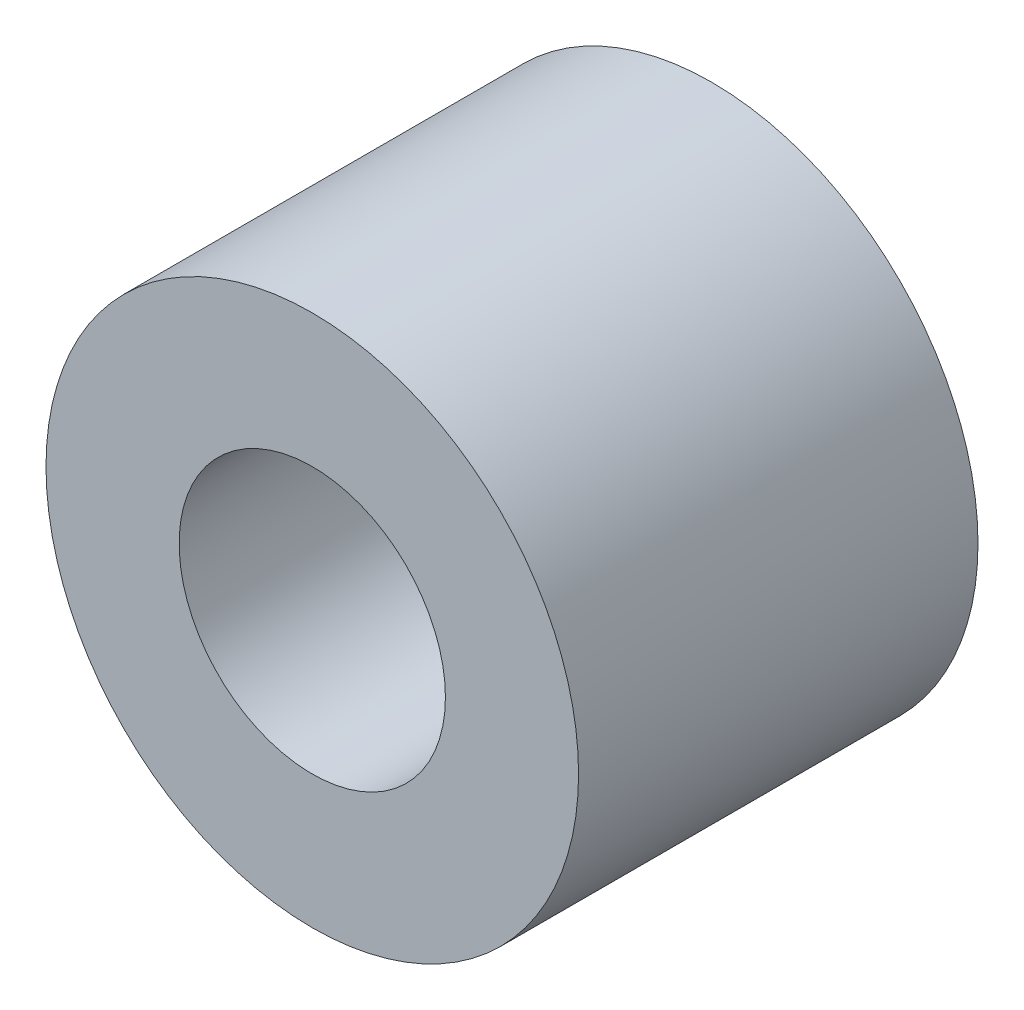
from build123d import *

# Parameters (mm, degrees)
SKETCH_1_R        = 4
SKETCH_1_R_2      = 2
EXTRUDE_223_DEPTH = 6


with BuildPart() as part:
    # 草图1 → Extrude 223 (new body)
    with BuildSketch(Plane.XY):
        Circle(SKETCH_1_R)
        Circle(SKETCH_1_R_2, mode=Mode.SUBTRACT)
    extrude(amount=EXTRUDE_223_DEPTH)


solid = part.part
